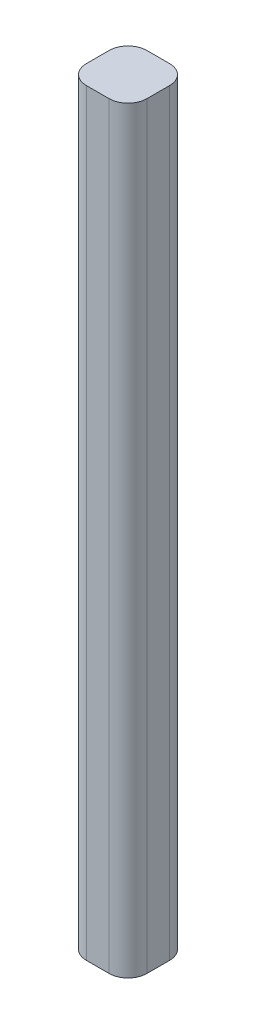
from build123d import *

# Parameters (mm, degrees)
BOSS_EXTRUDE1_DEPTH = 500


with BuildPart() as part:
    # Sketch1 → Boss-Extrude1 (new, symmetric)
    with BuildSketch(Plane(origin=(0, 0, 0), x_dir=(1, 0, 0), z_dir=(0, 1, 0))):
        with BuildLine():
            Line((15, -40), (-15, -40))
            ThreePointArc((-15, -40), (-32.67766953, -32.67766953), (-40, -15))
            Line((-40, -15), (-40, 15))
            ThreePointArc((-40, 15), (-32.67766953, 32.67766953), (-15, 40))
            Line((-15, 40), (15, 40))
            ThreePointArc((15, 40), (32.67766953, 32.67766953), (40, 15))
            Line((40, 15), (40, -15))
            ThreePointArc((40, -15), (32.67766953, -32.67766953), (15, -40))
        make_face()
    extrude(amount=BOSS_EXTRUDE1_DEPTH, both=True)


solid = part.part
